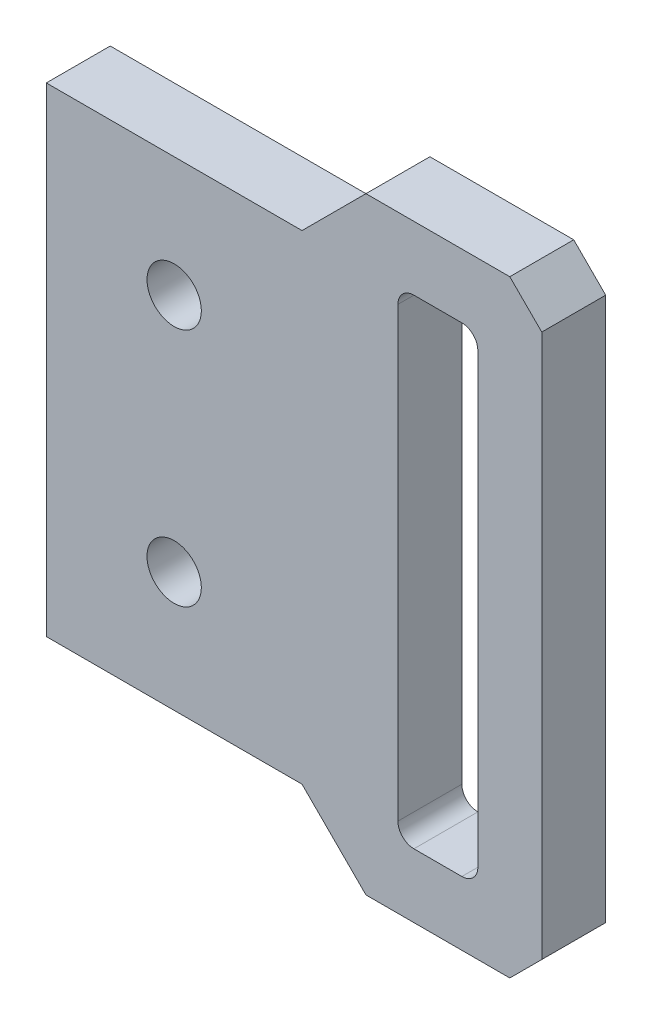
from build123d import *

# Parameters (mm, degrees)
SKETCH1_W                = 13
SKETCH1_H                = 38
SKETCH1_W_2              = 5
SKETCH1_H_2              = 30
BOSS_EXTRUDE1_DEPTH      = 4
CHAMFER1_SIZE            = 2
BOSS_EXTRUDE2_DEPTH      = 2
BOSS_EXTRUDE2_DEPTH_BACK = 2
SKETCH2_R                = 1.7
FILLET2_R                = 1


with BuildPart() as part:
    # Sketch1 → Boss-Extrude1 (new body)
    with BuildSketch(Plane.XY):
        Rectangle(SKETCH1_W, SKETCH1_H)
        Rectangle(SKETCH1_W_2, SKETCH1_H_2, mode=Mode.SUBTRACT)
    extrude(amount=BOSS_EXTRUDE1_DEPTH)

    # Chamfer1
    chamfer1_edges = [part.edges().sort_by_distance(p)[0] for p in [
        (-6.5, 19, 2),
        (6.5, -19, 2),
        (-6.5, -19, 2),
        (6.5, 19, 2),
    ]]
    chamfer(chamfer1_edges, length=CHAMFER1_SIZE)

    # Sketch2 → Boss-Extrude2 (add, two sides: drawn at the far end of the back side and taken through both)
    with BuildSketch(Plane.XY.offset(2).offset(-BOSS_EXTRUDE2_DEPTH_BACK)):
        Polygon((-6.5, 17), (-8.5, 15), (-24.5, 15), (-24.5, -15), (-8.5, -15), (-6.5, -17), align=None)
        with Locations((-16.5, 7.5)):
            Circle(SKETCH2_R, mode=Mode.SUBTRACT)
        with Locations((-16.5, -7.5)):
            Circle(SKETCH2_R, mode=Mode.SUBTRACT)
    extrude(amount=BOSS_EXTRUDE2_DEPTH + BOSS_EXTRUDE2_DEPTH_BACK)

    # Fillet2
    fillet2_edges = [part.edges().sort_by_distance(p)[0] for p in [
        (2.5, -15, 2),
        (-2.5, -15, 2),
        (2.5, 15, 2),
        (-2.5, 15, 2),
    ]]
    fillet(fillet2_edges, radius=FILLET2_R)


solid = part.part
